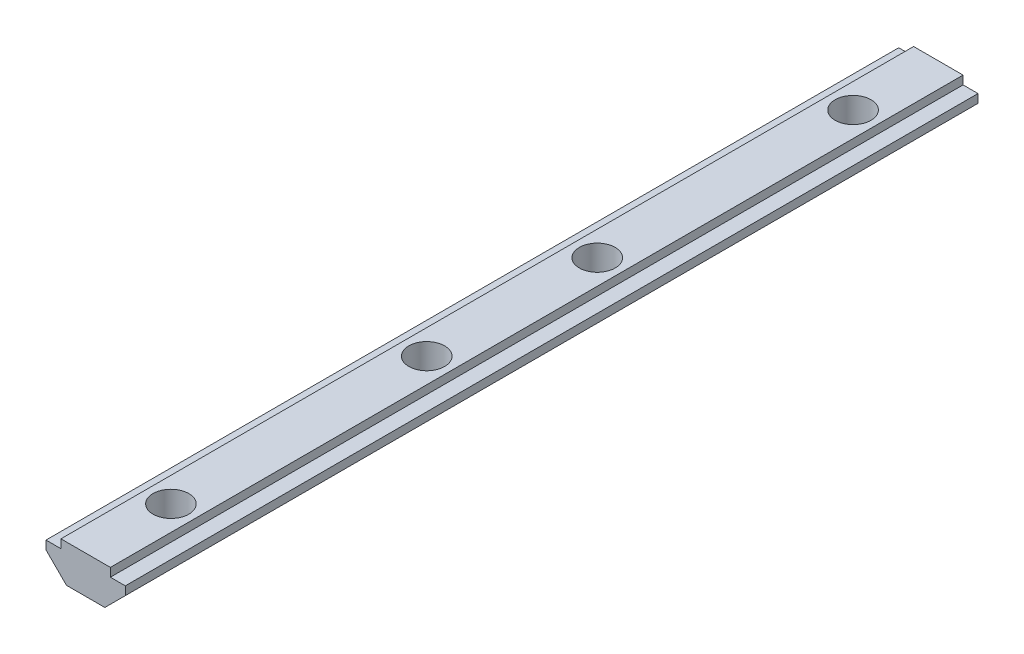
from build123d import *

# Parameters (mm, degrees)
BOSS_EXTRUDE1_DEPTH   = 100
M5X0_8_TAPPED_HOLE1_D = 4.2


with BuildPart() as part:
    # Sketch1 → Boss-Extrude1 (new body)
    with BuildSketch(Plane.XY):
        Polygon((2.25, 0), (-2.25, 0), (-4.65, 2.4), (-4.65, 3.4), (-2.9, 3.4), (-2.9, 4.4), (2.9, 4.4), (2.9, 3.4), (4.65, 3.4), (4.65, 2.4), align=None)
    extrude(amount=BOSS_EXTRUDE1_DEPTH)

    # M5x0.8 Tapped Hole1 (through all)
    with Locations(Plane(origin=(0, 4.4, 0), x_dir=(1, 0, 0), z_dir=(0, 1, 0))):
        with Locations((0, -10), (0, -40), (0, -60), (0, -90)):
            Hole(M5X0_8_TAPPED_HOLE1_D / 2)


solid = part.part
